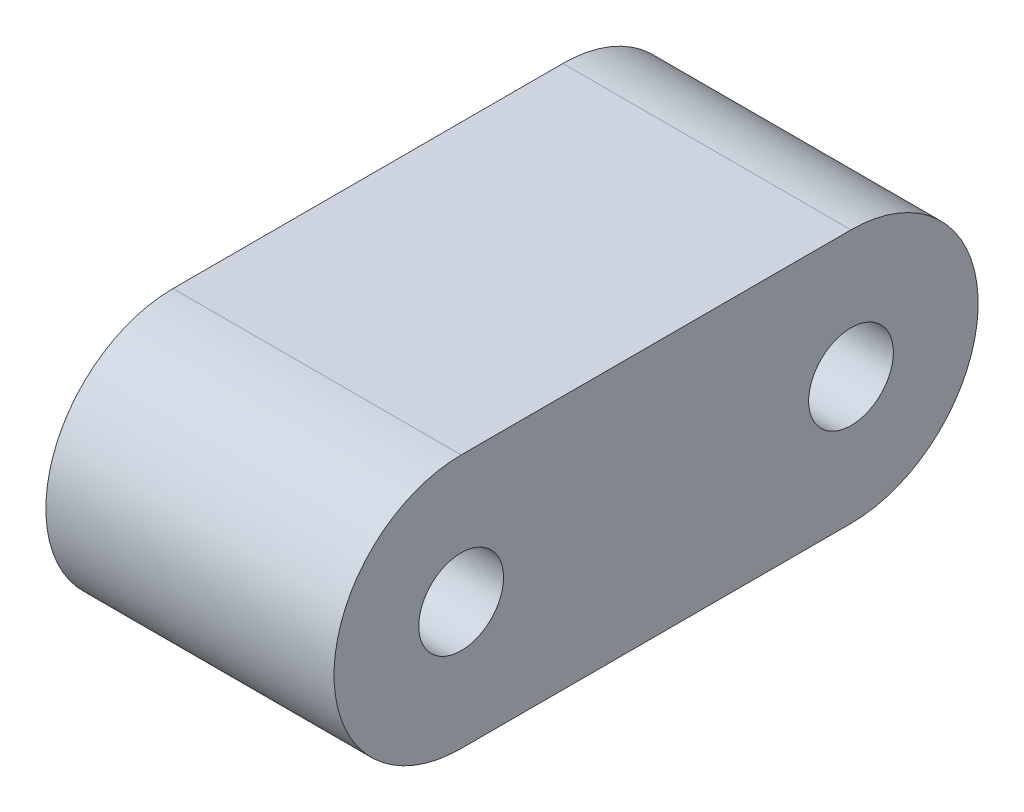
from build123d import *

# Parameters (mm, degrees)
CROQUIS1_R              = 2.5
SALIENTE_EXTRUIR1_DEPTH = 8.5


with BuildPart() as part:
    # Croquis1 → Saliente-Extruir1 (new, symmetric)
    with BuildSketch(Plane(origin=(0, 0, 0), x_dir=(0, 0, -1), z_dir=(1, 0, 0))):
        with BuildLine():
            Line((-11.5, 7.5), (11.5, 7.5))
            ThreePointArc((11.5, 7.5), (19, 0), (11.5, -7.5))
            Line((11.5, -7.5), (-11.5, -7.5))
            ThreePointArc((-11.5, -7.5), (-19, 0), (-11.5, 7.5))
        make_face()
        with Locations((-11.5, 0)):
            Circle(CROQUIS1_R, mode=Mode.SUBTRACT)
        with Locations((11.5, 0)):
            Circle(CROQUIS1_R, mode=Mode.SUBTRACT)
    extrude(amount=SALIENTE_EXTRUIR1_DEPTH, both=True)


solid = part.part
